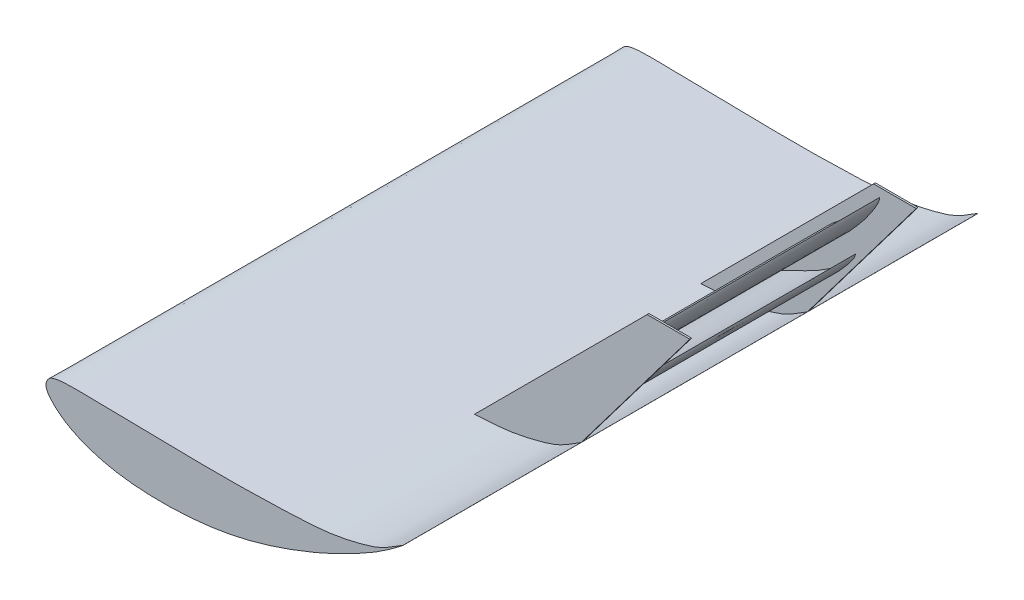
from build123d import *

# Parameters (mm, degrees)
BOSS_EXTRUDE1_DEPTH      = 450
BOSS_EXTRUDE1_DEPTH_BACK = 190
BOSS_EXTRUDE2_DEPTH      = 250
BOSS_EXTRUDE3_DEPTH      = 250
BOSS_EXTRUDE4_DEPTH      = 2


with BuildPart() as part:
    # Sketch2 → Boss-Extrude1 (new, two sides: drawn at the far end of the back side and taken through both)
    with BuildSketch(Plane.XY.offset(-BOSS_EXTRUDE1_DEPTH_BACK)):
        with BuildLine():
            add(Edge.make_bspline(
                [(331.632547469, -0.155801536), (331.304804648, -0.038615704), (310.948001787, -13.886411779), (288.850742925, -21.453130062), (253.898831549, -29.814375257), (214.402036751, -32.174399069), (174.203238421, -33.535466036), (134.096691432, -34.220910528), (93.868451095, -33.829088664), (53.62355674, -32.933544742), (20.067576666, -32.58062124), (-6.777768577, -32.081964586), (-26.866972083, -31.763971163), (-43.660957345, -31.602077129), (-55.316512, -33.133657225), (-63.217346314, -35.786601004), (-68.168954816, -45.852182452), (-60.935621688, -55.143256382), (-52.810223066, -63.238049464), (-43.602034193, -69.792541019), (-32.757735565, -75.632989434), (-18.848696071, -81.50408464), (-1.571951466, -86.671839376), (25.726118264, -91.610196978), (59.59912915, -93.637086079), (99.829747098, -91.985368399), (139.702918156, -86.499514592), (178.98654912, -76.560782021), (217.989675389, -62.830670059), (256.048180454, -46.795741281), (289.832491564, -28.762312202), (310.639103485, -16.232870327), (331.977351639, -0.279087725), (331.632547469, -0.155801536)],
                knots=[0, 0, 0, 0, 0.026267805, 0.05101645, 0.098803999, 0.146245906, 0.193788091, 0.241403109, 0.289125069, 0.336906896, 0.384666303, 0.408554379, 0.43243685, 0.456234374, 0.468111913, 0.474323291, 0.485191068, 0.501620174, 0.510955397, 0.526909994, 0.541277728, 0.554823463, 0.580548385, 0.605270102, 0.653410558, 0.700937477, 0.748405772, 0.79632416, 0.845052217, 0.894743241, 0.94586851, 0.972364768, 1, 1, 1, 1], degree=3))
        make_face()
    extrude(amount=BOSS_EXTRUDE1_DEPTH + BOSS_EXTRUDE1_DEPTH_BACK)



with BuildPart() as body_2:
    # Sketch2<3> → Boss-Extrude2 (new body)
    with BuildSketch(Plane.XY):
        with BuildLine():
            add(Edge.make_bspline(
                [(385.257108205, 82.500998533), (385.262718652, 82.657045888), (384.403940943, 80.687432876), (383.657706576, 79.56840288), (382.553376289, 77.880744826), (381.233954331, 76.184864639), (379.61594752, 74.258915124), (377.736638316, 72.185446603), (375.60037444, 70.008528092), (373.309357382, 67.729611065), (370.848412879, 65.463576841), (368.293558252, 63.204775791), (365.670442902, 60.975213159), (362.960640755, 58.823348985), (360.203555415, 56.707277406), (357.380855488, 54.655553979), (354.491780752, 52.664392505), (351.549990289, 50.712937144), (348.535317242, 48.824783821), (345.459140164, 46.97521262), (342.311610123, 45.164747337), (339.089536673, 43.392367707), (335.790722934, 41.638176888), (332.415279089, 39.903970969), (328.964217848, 38.171435976), (325.436978114, 36.454789012), (321.858304333, 34.715167763), (318.229022674, 32.983721032), (314.604470592, 31.240931416), (311.029640761, 29.517736405), (307.560681425, 27.861865366), (304.282963455, 26.214837697), (301.21634104, 24.634441536), (298.438022747, 23.094390469), (295.987599383, 21.705919431), (293.95353301, 20.479373817), (292.319432576, 19.464657151), (291.025508113, 18.656269033), (290.006404313, 17.976500048), (289.197724902, 17.387794544), (288.519811704, 16.890485717), (287.960517662, 16.43974363), (287.491120754, 16.025982717), (287.102483552, 15.628801651), (286.801311256, 15.221074048), (286.620429119, 14.776157027), (286.630563726, 14.313890741), (286.79585874, 13.900921156), (287.049630073, 13.538720769), (287.33911776, 13.180813577), (287.701362098, 12.840834513), (288.12857904, 12.511641561), (288.613828785, 12.17448135), (289.174108848, 11.837901495), (289.831514382, 11.525459152), (290.574572898, 11.185189517), (291.448138906, 10.886107434), (292.456337958, 10.57903469), (293.639228133, 10.330006302), (295.008806857, 10.106803979), (296.581131911, 9.935256527), (298.356625654, 9.840500169), (300.302687346, 9.838403517), (302.383471629, 9.965075455), (304.550884742, 10.23286767), (306.770919976, 10.662341838), (309.014855996, 11.254763585), (311.277583013, 12.004951978), (313.554633497, 12.923876771), (315.843408831, 14.040342457), (318.179815559, 15.317754704), (320.56157534, 16.827336468), (323.046696009, 18.540389618), (325.646982127, 20.497688236), (328.400201588, 22.653022964), (331.288852626, 24.971043441), (334.271310095, 27.418603889), (337.317258268, 29.936530581), (340.392398086, 32.478079948), (343.429471804, 35.041894513), (346.434689872, 37.565239214), (349.369794303, 40.070591518), (352.210756975, 42.580941419), (354.983071887, 45.080285535), (357.691572396, 47.589560364), (360.325362768, 50.144615375), (362.915500017, 52.741685683), (365.469865367, 55.378268458), (367.979827785, 58.066762505), (370.450880224, 60.774207375), (372.8462526, 63.48980126), (375.132812849, 66.162720111), (377.240585914, 68.748948508), (379.141540172, 71.160075747), (380.769551114, 73.369334894), (382.123157635, 75.328211383), (383.196109299, 77.0816532), (384.035946379, 78.61947015), (384.607394543, 80.176109737), (384.884574537, 81.247822033), (385.253896678, 82.411674068), (385.257108205, 82.500998533)],
                knots=[0, 0, 0, 0, 0.00687178, 0.013318497, 0.020777589, 0.02943689, 0.039410878, 0.050612524, 0.062849331, 0.075765159, 0.089149388, 0.102734838, 0.116433622, 0.130198357, 0.143995866, 0.157878947, 0.171808007, 0.185837334, 0.19997499, 0.214225182, 0.228640874, 0.243274633, 0.258077981, 0.273195932, 0.288529679, 0.304128025, 0.319976941, 0.335982504, 0.352082187, 0.367938781, 0.383309211, 0.397921185, 0.411683605, 0.424447294, 0.435801067, 0.445269473, 0.452770848, 0.458740355, 0.463463732, 0.467375516, 0.470668278, 0.473489106, 0.475938642, 0.478127703, 0.480104281, 0.481956658, 0.483742746, 0.485466599, 0.487184503, 0.489002786, 0.490948619, 0.493091457, 0.495430759, 0.497992892, 0.500874767, 0.504106146, 0.507732688, 0.511874729, 0.516668635, 0.522133279, 0.528420065, 0.535519847, 0.543327695, 0.551615211, 0.560364178, 0.569353407, 0.578559851, 0.588022127, 0.597764961, 0.607818479, 0.618374991, 0.629504087, 0.641429754, 0.654362395, 0.668309494, 0.683127591, 0.698529964, 0.714320123, 0.730256731, 0.746106292, 0.761718272, 0.777054096, 0.792125015, 0.806928363, 0.821567252, 0.836153821, 0.850685769, 0.865307939, 0.87993042, 0.894546754, 0.909020415, 0.923112208, 0.936492017, 0.948805381, 0.959726546, 0.969206481, 0.977217575, 0.98415149, 0.990330215, 0.996066463, 1, 1, 1, 1], degree=3))
        make_face()
    extrude(amount=BOSS_EXTRUDE2_DEPTH)


with BuildPart() as body_3:
    # Sketch2<4> → Boss-Extrude3 (new body)
    with BuildSketch(Plane.XY):
        with BuildLine():
            add(Edge.make_bspline(
                [(412.154609526, 150.484462569), (412.140228109, 150.587563161), (411.804420618, 149.195019595), (411.444034038, 148.37394516), (410.914371183, 147.138089374), (410.244444203, 145.871935257), (409.405118851, 144.420165959), (408.411316021, 142.841294963), (407.26078849, 141.164758592), (406.020467443, 139.403341197), (404.667091101, 137.630710129), (403.251221795, 135.851956371), (401.787151898, 134.084496527), (400.257173984, 132.358013376), (398.692009287, 130.649555681), (397.076316795, 128.975749124), (395.410035703, 127.33401991), (393.704548111, 125.712256629), (391.943882107, 124.123616288), (390.138369862, 122.553186552), (388.281484535, 121.000171151), (386.371249588, 119.463530895), (384.40852605, 117.929948419), (382.393178336, 116.400615682), (380.327991454, 114.863626089), (378.210951174, 113.328248762), (376.062802091, 111.771833645), (373.880480661, 110.214926771), (371.702577493, 108.651120378), (369.55505052, 107.105934717), (367.469237813, 105.61720598), (365.507958669, 104.156422401), (363.677558258, 102.763822543), (362.031770035, 101.43108645), (360.583709728, 100.235827387), (359.390258446, 99.195078354), (358.434877728, 98.339705419), (357.678949914, 97.659175745), (357.088562796, 97.094904222), (356.625785385, 96.614779255), (356.238280452, 96.209797935), (355.92326274, 95.849121473), (355.662984816, 95.523131558), (355.453809375, 95.217376135), (355.303278937, 94.914821918), (355.23602887, 94.601776861), (355.296197095, 94.299454484), (355.452527247, 94.047459503), (355.661068189, 93.839038956), (355.892561289, 93.637571778), (356.169746474, 93.456297812), (356.488340016, 93.289626927), (356.845956661, 93.124443423), (357.252766413, 92.968326863), (357.720548487, 92.839301284), (358.24778648, 92.701921672), (358.855939571, 92.606691533), (359.553409481, 92.521801073), (360.358851308, 92.495242163), (361.283871589, 92.507251144), (362.336022794, 92.576644557), (363.512672308, 92.719974196), (364.790579456, 92.943884373), (366.142030218, 93.267932311), (367.53401929, 93.694659769), (368.941839626, 94.233629477), (370.346488048, 94.882347431), (371.745209556, 95.63682061), (373.133801126, 96.503733895), (374.507222101, 97.501697714), (375.893282868, 98.610843218), (377.282242452, 99.877667265), (378.715507482, 101.290043731), (380.196107875, 102.876108931), (381.754189157, 104.609896859), (383.382353095, 106.466172544), (385.057108313, 108.418355749), (386.765401642, 110.424087135), (388.490125721, 112.448707099), (390.187280399, 114.483538284), (391.868205628, 116.488111662), (393.505181453, 118.472755601), (395.07977104, 120.449782292), (396.610564819, 122.411636222), (398.098312352, 124.372622544), (399.531710039, 126.355016465), (400.931583852, 128.359941524), (402.303397855, 130.386666888), (403.640050093, 132.442333676), (404.948962582, 134.505937977), (406.20724482, 136.566131284), (407.399028003, 138.585710102), (408.483466274, 140.527675921), (409.452390702, 142.330738615), (410.265486683, 143.969669729), (410.927411259, 145.412448434), (411.428857353, 146.687861232), (411.802216658, 147.794721388), (411.997189294, 148.882869166), (412.055101374, 149.618577418), (412.162841723, 150.425445835), (412.154609526, 150.484462569)],
                knots=[0, 0, 0, 0, 0.00687178, 0.013318497, 0.020777589, 0.02943689, 0.039410878, 0.050612524, 0.062849331, 0.075765159, 0.089149388, 0.102734838, 0.116433622, 0.130198357, 0.143995866, 0.157878947, 0.171808007, 0.185837334, 0.19997499, 0.214225182, 0.228640874, 0.243274633, 0.258077981, 0.273195932, 0.288529679, 0.304128025, 0.319976941, 0.335982504, 0.352082187, 0.367938781, 0.383309211, 0.397921185, 0.411683605, 0.424447294, 0.435801067, 0.445269473, 0.452770848, 0.458740355, 0.463463732, 0.467375516, 0.470668278, 0.473489106, 0.475938642, 0.478127703, 0.480104281, 0.481956658, 0.483742746, 0.485466599, 0.487184503, 0.489002786, 0.490948619, 0.493091457, 0.495430759, 0.497992892, 0.500874767, 0.504106146, 0.507732688, 0.511874729, 0.516668635, 0.522133279, 0.528420065, 0.535519847, 0.543327695, 0.551615211, 0.560364178, 0.569353407, 0.578559851, 0.588022127, 0.597764961, 0.607818479, 0.618374991, 0.629504087, 0.641429754, 0.654362395, 0.668309494, 0.683127591, 0.698529964, 0.714320123, 0.730256731, 0.746106292, 0.761718272, 0.777054096, 0.792125015, 0.806928363, 0.821567252, 0.836153821, 0.850685769, 0.865307939, 0.87993042, 0.894546754, 0.909020415, 0.923112208, 0.936492017, 0.948805381, 0.959726546, 0.969206481, 0.977217575, 0.98415149, 0.990330215, 0.996066463, 1, 1, 1, 1], degree=3))
        make_face()
    extrude(amount=BOSS_EXTRUDE3_DEPTH)


with BuildPart() as part_1:
    add(part.part)

    add(body_2.part)  # Boss-Extrude4 merges body 2

    add(body_3.part)  # Boss-Extrude4 merges body 3
    # Sketch3 → Boss-Extrude4 (add)
    with BuildSketch(Plane.XY):
        with BuildLine():
            Line((213.125966849, -32.061833101), (405.369105002, 160.181305053))
            Line((405.369105002, 160.181305053), (452.864487175, 160.181305053))
            Line((452.864487175, 160.181305053), (331.632547469, -0.155801536))
            add(Edge.make_bspline(
                [(331.632547469, -0.155801536), (331.304804648, -0.038615704), (310.948001787, -13.886411779), (288.850742925, -21.453130062), (253.898831549, -29.814375257), (227.164983916, -31.411783789), (213.51914951, -32.043772488), (213.125966849, -32.061833101)],
                knots=[0, 0, 0, 0, 0.026267805, 0.05101645, 0.098803999, 0.146245906, 0.147653033, 0.147653033, 0.147653033, 0.147653033], degree=3))
        make_face()
    boss_extrude4 = extrude(amount=-BOSS_EXTRUDE4_DEPTH)

    # Mirror1: Boss-Extrude4 across plane
    add(boss_extrude4.mirror(Plane.XY.offset(125)))


solid = part_1.part
